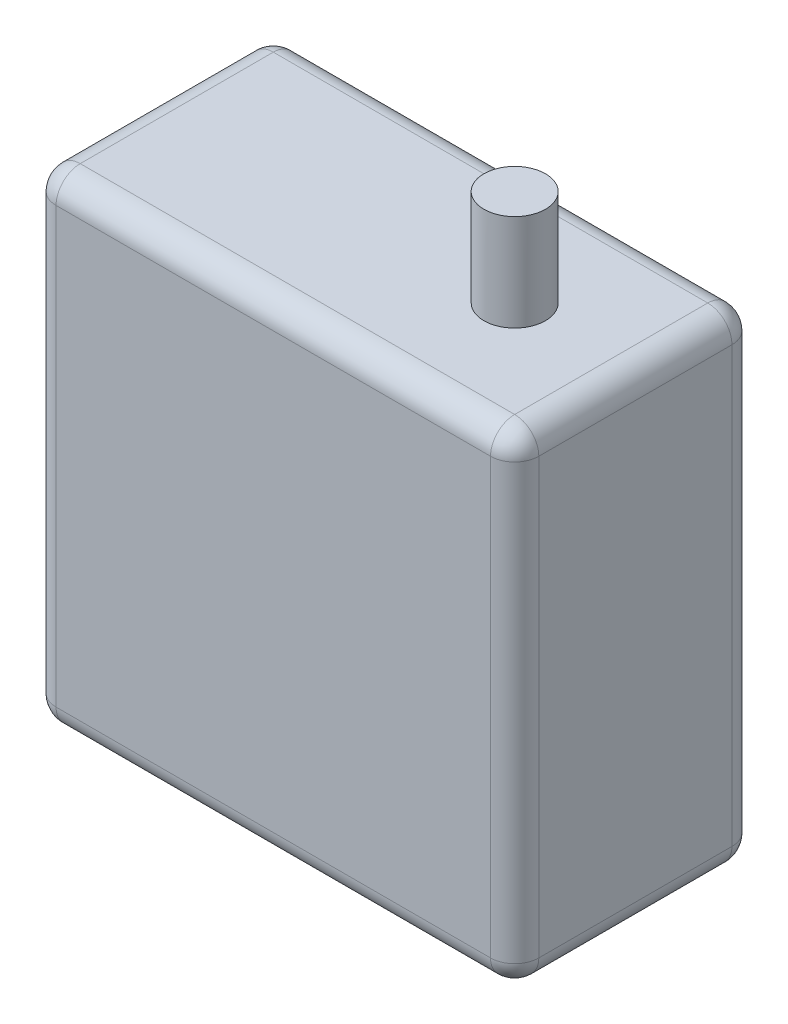
from build123d import *

# Parameters (mm, degrees)
SKETCH_1_W      = 40
SKETCH_1_H      = 20
EXTRUDE_1_DEPTH = 40
SKETCH_2_R      = 2.55
EXTRUDE_2_DEPTH = 8
FILLET_1_R      = 2


with BuildPart() as part:
    # 草图1 → 凸台-拉伸1 (new body)
    with BuildSketch(Plane(origin=(0, 0, 0), x_dir=(1, 0, 0), z_dir=(0, 1, 0))):
        Rectangle(SKETCH_1_W, SKETCH_1_H)
    extrude(amount=EXTRUDE_1_DEPTH)

    # 草图2 → 凸台-拉伸2 (add)
    with BuildSketch(Plane(origin=(0, 40, 0), x_dir=(1, 0, 0), z_dir=(0, 1, 0))):
        with Locations(Location((10, 0, 0), (0, 0, 90))):
            Circle(SKETCH_2_R)
    extrude(amount=EXTRUDE_2_DEPTH)

    # 圆角1
    fillet_1_edges = [part.edges().sort_by_distance(p)[0] for p in [
        (-20, 40, 0),
        (0, 40, 10),
        (20, 40, 0),
        (0, 0, 10),
        (-20, 0, 0),
        (0, 0, -10),
        (20, 0, 0),
        (20, 20, 10),
        (-20, 20, 10),
        (-20, 20, -10),
        (20, 20, -10),
        (0, 40, -10),
    ]]
    fillet(fillet_1_edges, radius=FILLET_1_R)


solid = part.part
